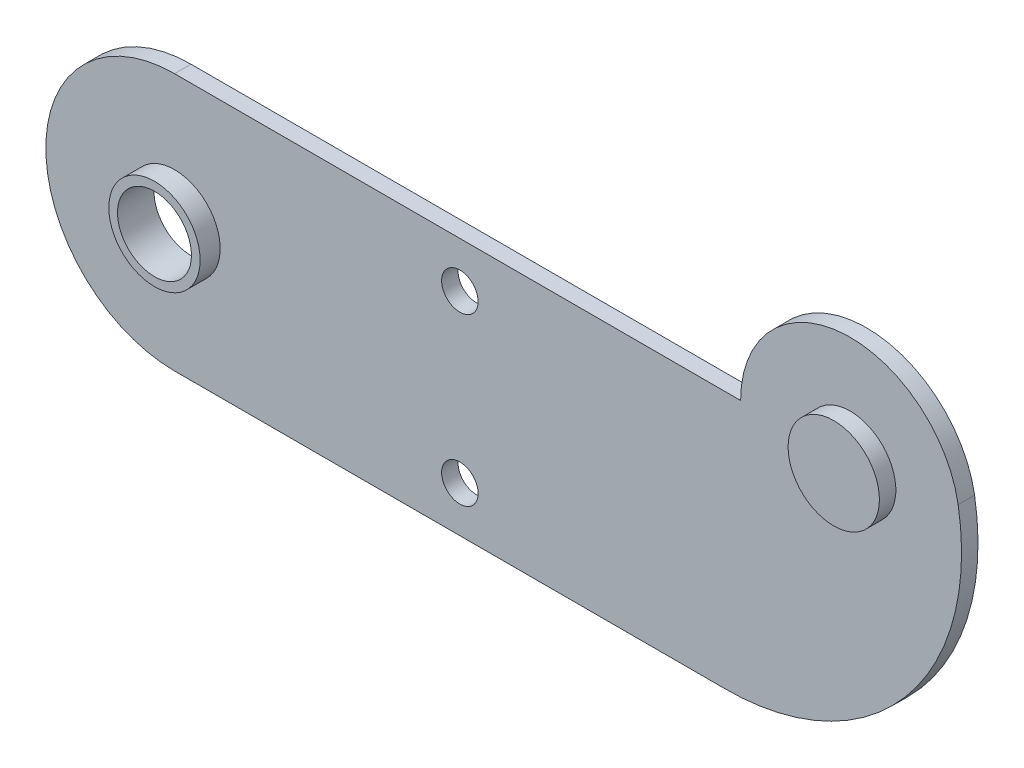
from build123d import *

# Parameters (mm, degrees)
ESBO_O1_R                = 4.05
ESBO_O1_R_2              = 2
RESSALTO_EXTRUS_O1_DEPTH = 1.8
ESBO_O2_R                = 5
RESSALTO_EXTRUS_O2_DEPTH = 3.6
ESBO_O4_R                = 5
ESBO_O4_R_2              = 4.05
RESSALTO_EXTRUS_O3_DEPTH = 2.2


with BuildPart() as part:
    # Esboço1 → Ressalto-extrusão1 (new body)
    with BuildSketch(Plane.XY):
        with BuildLine():
            Line((-12, 0), (-74, 0))
            ThreePointArc((-74, 0), (-88.1, -14.1), (-74, -28.2))
            Line((-74, -28.2), (-14, -28.2))
            ThreePointArc((-14, -28.2), (6.004940765, -19.140656488), (11.826301138, 2.034355278))
            ThreePointArc((11.826301138, 2.034355278), (-1.020878628, 11.956496428), (-12, 0))
        make_face()
        with Locations((-74, -14.1)):
            Circle(ESBO_O1_R, mode=Mode.SUBTRACT)
        with Locations((-42.75, -5)):
            Circle(ESBO_O1_R_2, mode=Mode.SUBTRACT)
        with Locations((-42.75, -23.2)):
            Circle(ESBO_O1_R_2, mode=Mode.SUBTRACT)
    extrude(amount=RESSALTO_EXTRUS_O1_DEPTH)

    # Esboço2 → Ressalto-extrusão2 (add)
    with BuildSketch(Plane.XY):
        with Locations(Location((0, 0, 0), (0, 0, 180))):
            Circle(ESBO_O2_R)
    extrude(amount=RESSALTO_EXTRUS_O2_DEPTH)

    # Esboço4 → Ressalto-extrusão3 (add)
    with BuildSketch(Plane.XY.offset(1.8)):
        with Locations(Location((-74, -14.1, 0), (0, 0, 180))):
            Circle(ESBO_O4_R)
        with Locations((-74, -14.1)):
            Circle(ESBO_O4_R_2, mode=Mode.SUBTRACT)
    extrude(amount=RESSALTO_EXTRUS_O3_DEPTH)


solid = part.part
